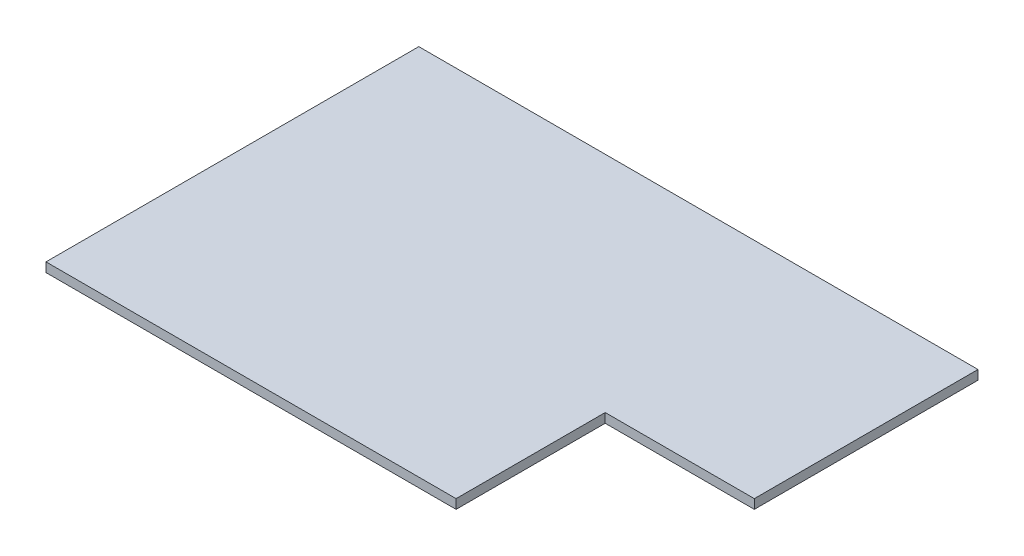
from build123d import *

# Parameters (mm, degrees)
SKETCH2_W           = 190.5
SKETCH2_H           = 127
BOSS_EXTRUDE1_DEPTH = 3.175
SKETCH3_W           = 50.8
SKETCH3_H           = 50.8
CUT_EXTRUDE1_DEPTH  = 115.52027386


with BuildPart() as part:
    # Sketch2 → Boss-Extrude1 (new body)
    with BuildSketch(Plane(origin=(0, 0, 0), x_dir=(1, 0, 0), z_dir=(0, 1, 0))):
        Rectangle(SKETCH2_W, SKETCH2_H)
    extrude(amount=BOSS_EXTRUDE1_DEPTH)

    # Sketch3 → Cut-Extrude1 (cut, through all)
    with BuildSketch(Plane(origin=(0, 3.175, 0), x_dir=(1, 0, 0), z_dir=(0, 1, 0))):
        with Locations((69.85, -38.1)):
            Rectangle(SKETCH3_W, SKETCH3_H)
    extrude(amount=-CUT_EXTRUDE1_DEPTH, mode=Mode.SUBTRACT)


solid = part.part
